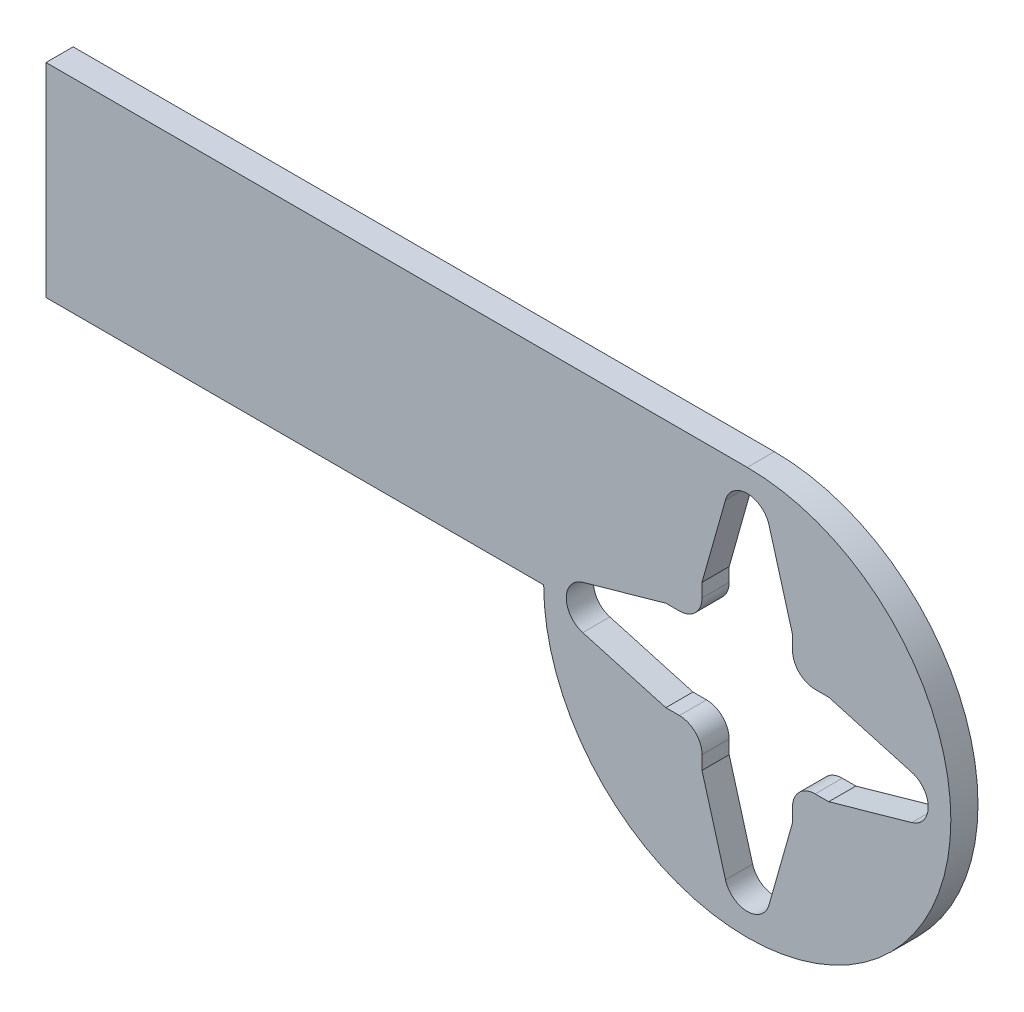
from build123d import *

# Parameters (mm, degrees)
SKETCH1_R           = 2.5
SKETCH1_W           = 55
SKETCH1_H           = 22.5
BOSS_EXTRUDE1_DEPTH = 3


with BuildPart() as part:
    # Sketch1 → Boss-Extrude1 (new body)
    # profile 1 of 7: a face of its own
    with BuildSketch(Plane.XY):
        with BuildLine():
            ThreePointArc((22.5, 0), (15.909902577, 15.909902577), (0, 22.5))
            Line((0, 22.5), (-22.5, 0))
            ThreePointArc((-22.5, 0), (-22.471786645, -1.126412439), (-22.387217335, -2.25))
            ThreePointArc((-22.387217335, -2.25), (1.126412439, -22.471786645), (22.5, 0))
        make_face()
        with BuildLine():
            ThreePointArc((-7.5, 5), (-9.267766953, 9.267766953), (-5, 7.5))
            Line((-5, 7.5), (-5, 9))
            Line((-5, 9), (-2.405779746, 18.179870439))
            ThreePointArc((-2.405779746, 18.179870439), (0, 20), (2.405779746, 18.179870439))
            Line((2.405779746, 18.179870439), (5, 9))
            Line((5, 9), (5, 7.5))
            ThreePointArc((5, 7.5), (7.5, 10), (10, 7.5))
            ThreePointArc((10, 7.5), (9.267766953, 5.732233047), (7.5, 5))
            Line((7.5, 5), (9, 5))
            Line((9, 5), (18.179870439, 2.405779746))
            ThreePointArc((18.179870439, 2.405779746), (19.493699588, 1.508363998), (20, 0))
            ThreePointArc((20, 0), (19.493699588, -1.508363998), (18.179870439, -2.405779746))
            Line((18.179870439, -2.405779746), (9, -5))
            Line((9, -5), (7.5, -5))
            ThreePointArc((7.5, -5), (9.267766953, -5.732233047), (10, -7.5))
            ThreePointArc((10, -7.5), (7.5, -10), (5, -7.5))
            Line((5, -7.5), (5, -9))
            Line((5, -9), (2.405779746, -18.179870439))
            ThreePointArc((2.405779746, -18.179870439), (0, -20), (-2.405779746, -18.179870439))
            Line((-2.405779746, -18.179870439), (-5, -9))
            Line((-5, -9), (-5, -7.5))
            ThreePointArc((-5, -7.5), (-9.267766953, -9.267766953), (-7.5, -5))
            Line((-7.5, -5), (-9, -5))
            Line((-9, -5), (-18.179870439, -2.405779746))
            ThreePointArc((-18.179870439, -2.405779746), (-20, 0), (-18.179870439, 2.405779746))
            Line((-18.179870439, 2.405779746), (-9, 5))
            Line((-9, 5), (-7.5, 5))
        make_face(mode=Mode.SUBTRACT)
    # profile 2 of 7: a face of its own
    with BuildSketch(Plane.XY):
        with Locations((-7.5, 7.5)):
            Circle(SKETCH1_R)
    # profile 3 of 7: a face of its own
    with BuildSketch(Plane.XY):
        with Locations((7.5, 7.5)):
            Circle(SKETCH1_R)
    # profile 4 of 7: a face of its own
    with BuildSketch(Plane.XY):
        with Locations((7.5, -7.5)):
            Circle(SKETCH1_R)
    # profile 5 of 7: a face of its own
    with BuildSketch(Plane.XY):
        with Locations((-7.5, -7.5)):
            Circle(SKETCH1_R)
    # profile 6 of 7: a face of its own
    with BuildSketch(Plane.XY):
        Polygon((-22.5, 22.5), (0, 22.5), (-22.5, 0), align=None)
    # profile 7 of 7: a face of its own
    with BuildSketch(Plane.XY):
        with Locations((-50, 11.25)):
            Rectangle(SKETCH1_W, SKETCH1_H)
    extrude(amount=BOSS_EXTRUDE1_DEPTH)


solid = part.part
